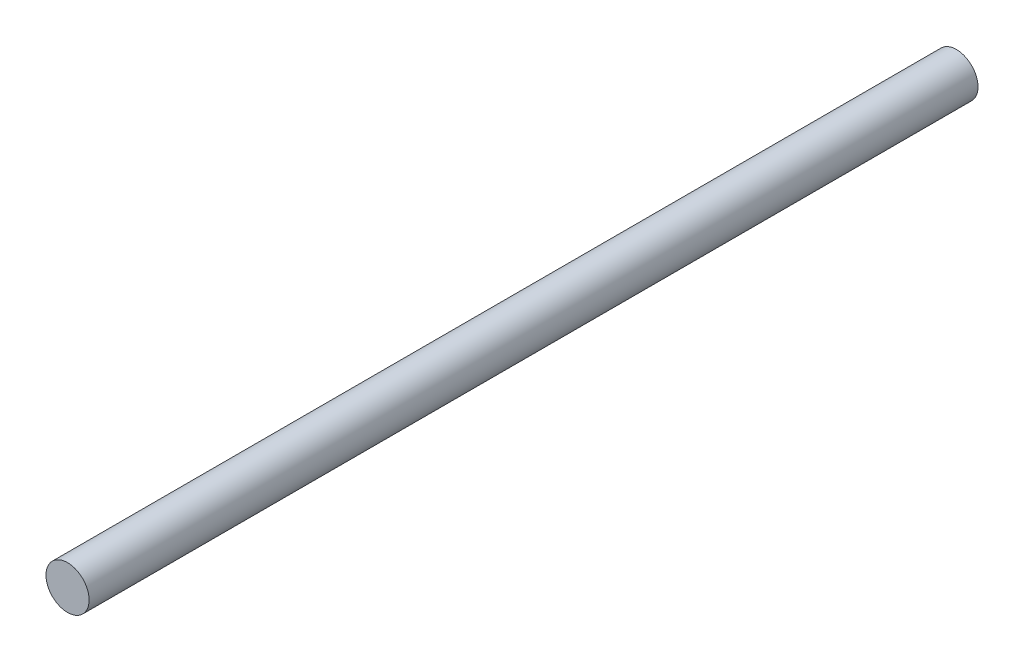
from build123d import *

# Parameters (mm, degrees)
SKETCH1_R           = 1.5
BOSS_EXTRUDE1_DEPTH = 61.77


with BuildPart() as part:
    # Sketch1 → Boss-Extrude1 (new body)
    with BuildSketch(Plane.XY):
        Circle(SKETCH1_R)
    extrude(amount=BOSS_EXTRUDE1_DEPTH)


solid = part.part
